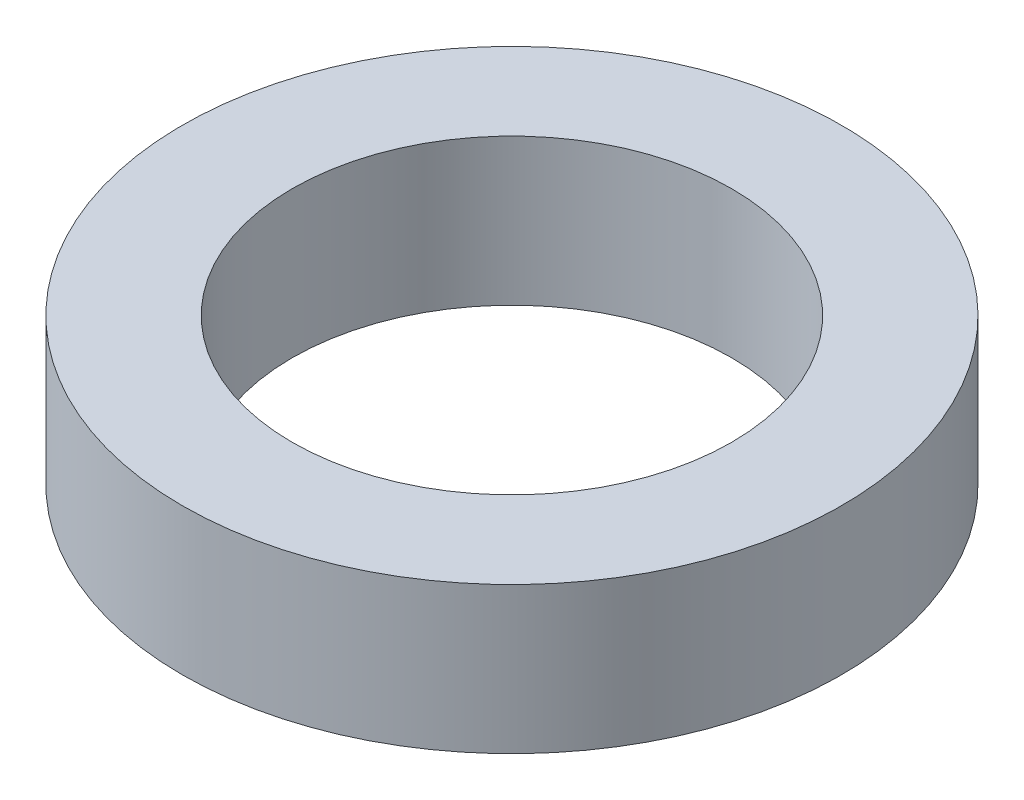
from build123d import *

# Parameters (mm, degrees)
SKETCH1_R           = 9
SKETCH1_R_2         = 6
BOSS_EXTRUDE1_DEPTH = 4


with BuildPart() as part:
    # Sketch1 → Boss-Extrude1 (new body)
    with BuildSketch(Plane(origin=(0, 0, 0), x_dir=(1, 0, 0), z_dir=(0, 1, 0))):
        with Locations(Location((0, 0, 0), (0, 0, 270))):
            Circle(SKETCH1_R)
        with Locations(Location((0, 0, 0), (0, 0, 270))):
            Circle(SKETCH1_R_2, mode=Mode.SUBTRACT)
    extrude(amount=BOSS_EXTRUDE1_DEPTH)


solid = part.part
